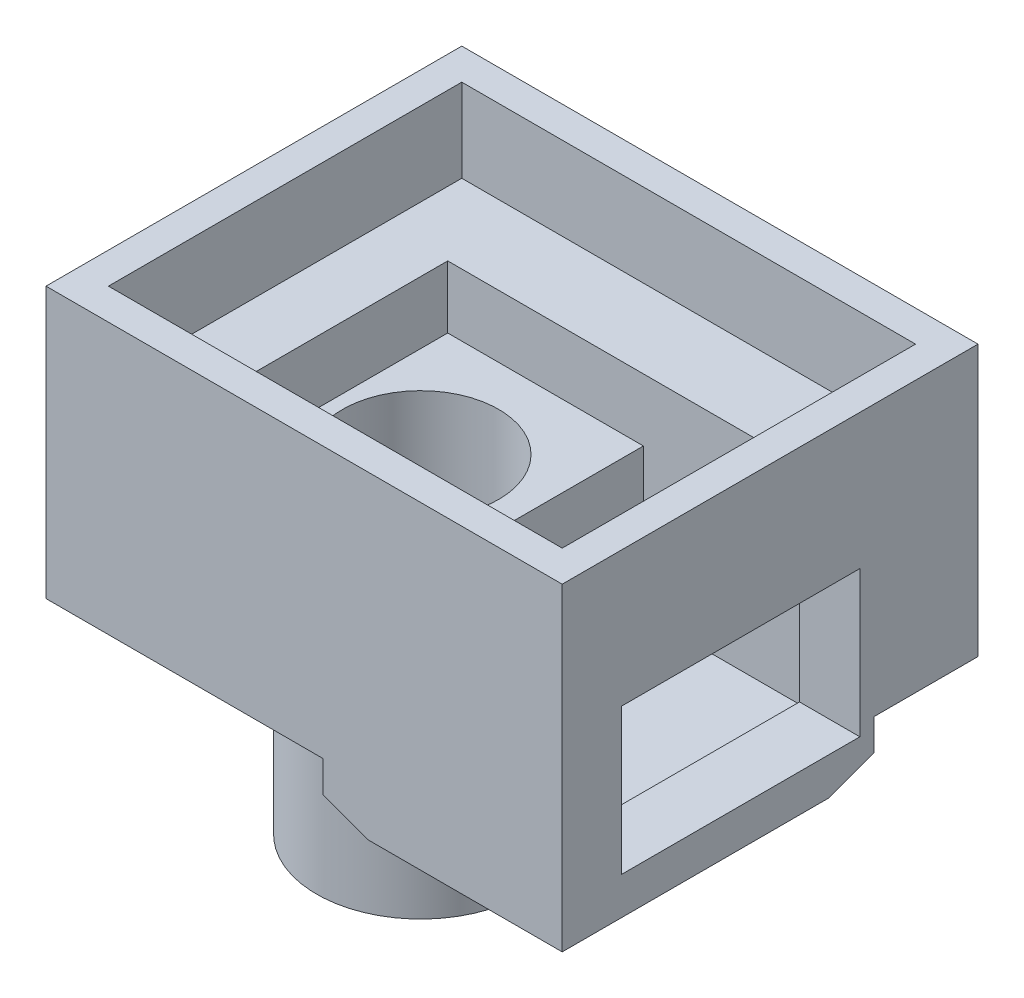
from build123d import *
from OCP.BRepFilletAPI import BRepFilletAPI_MakeChamfer

# Parameters (mm, degrees)
SKETCH1_R            = 4.999999999999999
SKETCH1_R_2          = 2.5
BOSS_EXTRUDE1_DEPTH  = 15.8
SKETCH2_R            = 3.75
CUT_EXTRUDE1_DEPTH   = 13
CUT_EXTRUDE2_DEPTH   = 19.135324645563973
BOSS_EXTRUDE3_DEPTH  = 1
BOSS_EXTRUDE4_DEPTH  = 1
SKETCH13_R           = 5
BOSS_EXTRUDE7_DEPTH  = 10
CUT_EXTRUDE3_START   = -4
CUT_EXTRUDE3_DEPTH   = 4
CUT_EXTRUDE4_DEPTH   = 1
BOSS_EXTRUDE9_DEPTH  = 3
CUT_EXTRUDE6_DEPTH   = 7
BOSS_EXTRUDE10_DEPTH = 3
BOSS_EXTRUDE11_DEPTH = 2
CUT_EXTRUDE7_DEPTH   = 0.25
BOSS_EXTRUDE12_DEPTH = 1
SKETCH23_W           = 18.9749371855331
SKETCH23_H           = 13
BOSS_EXTRUDE13_DEPTH = 1
SKETCH24_W           = 23.799999999999997
SKETCH24_H           = 13
BOSS_EXTRUDE14_DEPTH = 1
BOSS_EXTRUDE15_DEPTH = 1
SKETCH26_W           = 11.45
SKETCH26_H           = 6.999999999999998
SKETCH26_W_2         = 10.45
SKETCH26_H_2         = 5.999999999999998
CUT_EXTRUDE8_DEPTH   = 34.46489573009899
CUT_EXTRUDE10_DEPTH  = 0.7
CHAMFER4_SIZE        = 0.8
CHAMFER4_SIZE2       = 2.1979819355637176


with BuildPart() as part:
    # Sketch1 → Boss-Extrude1 (new body)
    # profile 1 of 2: a face of its own
    with BuildSketch(Plane(origin=(0, 0, 0), x_dir=(1, 0, 0), z_dir=(0, 1, 0))):
        with BuildLine():
            Line((-0.5, 7), (-0.5, 4.9749371855331))
            ThreePointArc((-0.5000000000000004, 4.974937185533099), (3.1e-16, 4.999999999999999), (0.49999999999999994, 4.974937185533099))
            Line((0.5, 4.9749371855331), (0.5, 7))
            Line((0.5, 7), (-0.5, 7))
        make_face()
    # profile 2 of 2: a face of its own
    with BuildSketch(Plane(origin=(0, 0, 0), x_dir=(1, 0, 0), z_dir=(0, 1, 0))):
        Circle(SKETCH1_R)
        with Locations(Location((0, 0, 0), (0, 0, 270))):
            Circle(SKETCH1_R_2, mode=Mode.SUBTRACT)
    extrude(amount=BOSS_EXTRUDE1_DEPTH)

    # Sketch2 → Cut-Extrude1 (cut)
    with BuildSketch(Plane(origin=(0, 15.8, 0), x_dir=(1, 0, 0), z_dir=(0, 1, 0))):
        with Locations(Location((0, 0, 0), (0, 0, 270))):
            Circle(SKETCH2_R)
    extrude(amount=-CUT_EXTRUDE1_DEPTH, mode=Mode.SUBTRACT)

    # Sketch4 → Cut-Extrude2 (cut, through all)
    with BuildSketch(Plane(origin=(0.5, 0, 0), x_dir=(0, 0, -1), z_dir=(1, 0, 0))):
        Polygon((7, 0), (4.9749371855331, 0), (4.9749371855331, 2.5000000000000004), (7, 2.5), align=None)
    extrude(amount=-CUT_EXTRUDE2_DEPTH, mode=Mode.SUBTRACT)

    # Sketch10 → Boss-Extrude3 (add)
    with BuildSketch(Plane(origin=(0.5, 0, 0), x_dir=(0, 0, -1), z_dir=(1, 0, 0))):
        Polygon((4.9749371855331, 15.8), (9.974937185533099, 15.8), (9.974937185533099, 9.8), (4.974937185533101, 9.8), align=None)
    extrude(amount=-BOSS_EXTRUDE3_DEPTH)

    # Sketch12 → Boss-Extrude4 (add)
    with BuildSketch(Plane(origin=(0, 15.8, 0), x_dir=(1, 0, 0), z_dir=(0, 1, 0))):
        with BuildLine():
            Line((-3.75, -3.307189138830739), (-3.75, 3.307189138830739))
            ThreePointArc((-3.75, 3.307189138830739), (-5.000000000000001, -6.1e-16), (-3.75, -3.307189138830739))
        make_face()
    extrude(amount=BOSS_EXTRUDE4_DEPTH)

    # Sketch13 → Boss-Extrude7 (add)
    with BuildSketch(Plane.XZ.offset(-9.8)):
        Polygon((-8, 8), (14.799999999999997, 8), (14.8, -9.974937185533099), (-7.999999999999998, -9.974937185533099), align=None)
        with Locations(Location((0, 0, 0), (0, 0, 221.409622109))):
            Circle(SKETCH13_R, mode=Mode.SUBTRACT)
    extrude(amount=-BOSS_EXTRUDE7_DEPTH)

    # Sketch14 → Cut-Extrude3 (cut)
    with BuildSketch(Plane(origin=(0, 19.8, 0), x_dir=(1, 0, 0), z_dir=(0, 1, 0)).offset(CUT_EXTRUDE3_START)):
        Polygon((-4.400000000000001, 5.7), (10.299999999999999, 5.7), (12.899999999999999, 5.7), (12.899999999999999, -7.249999999999999), (10.3, -7.249999999999999), (-4.400000000000001, -7.249999999999999), align=None)
    extrude(amount=CUT_EXTRUDE3_DEPTH, mode=Mode.SUBTRACT)

    # Sketch15 → Cut-Extrude4 (cut)
    with BuildSketch(Plane(origin=(0, 19.8, 0), x_dir=(1, 0, 0), z_dir=(0, 1, 0))):
        Polygon((-7.499999999999998, 9.474937185533099), (-7.5, -7.5), (14.299999999999997, -7.5), (14.3, 9.474937185533099), align=None)
    extrude(amount=-CUT_EXTRUDE4_DEPTH, mode=Mode.SUBTRACT)

    # Sketch17 → Boss-Extrude9 (add)
    with BuildSketch(Plane.XZ.offset(-9.8)):
        Polygon((14.8, -5.974937185533098), (4.3, -5.974937185533099), (4.3, 8), (14.8, 8), align=None)
    extrude(amount=BOSS_EXTRUDE9_DEPTH)

    # Sketch16 → Cut-Extrude6 (cut)
    with BuildSketch(Plane(origin=(0, 15.8, 0), x_dir=(1, 0, 0), z_dir=(0, 1, 0))):
        Polygon((12.899999999999999, 5.7), (4.999999999999999, 5.699999999999999), (5.000000000000001, -7.249999999999999), (12.9, -7.249999999999999), align=None)
    extrude(amount=-CUT_EXTRUDE6_DEPTH, mode=Mode.SUBTRACT)

    # Sketch19 → Boss-Extrude10 (add)
    with BuildSketch(Plane(origin=(0, 19.8, 0), x_dir=(1, 0, 0), z_dir=(0, 1, 0))):
        Polygon((-7.999999999999998, 9.974937185533099), (-8, -8), (14.799999999999997, -8), (14.8, 9.974937185533099), align=None)
        Polygon((-7.5, -7.5), (14.299999999999997, -7.5), (14.3, 9.474937185533099), (-7.499999999999998, 9.474937185533099), align=None, mode=Mode.SUBTRACT)
    extrude(amount=BOSS_EXTRUDE10_DEPTH)

    # Sketch20 → Boss-Extrude11 (add)
    with BuildSketch(Plane(origin=(0, 16.8, 0), x_dir=(1, 0, 0), z_dir=(0, 1, 0))):
        with BuildLine():
            Line((-4.400000000000002, -2.37486841740758), (-4.400000000000001, 2.374868417407581))
            ThreePointArc((-4.400000000000001, 2.374868417407581), (-5, 6.1e-16), (-4.400000000000002, -2.37486841740758))
        make_face()
    extrude(amount=BOSS_EXTRUDE11_DEPTH)

    # Sketch21 → Cut-Extrude7 (cut)
    with BuildSketch(Plane(origin=(0, 0, 7.249999999999999), x_dir=(-1, 0, 0), z_dir=(0, 0, -1))):
        Polygon((4.400000000000001, 18.8), (-12.899999999999999, 18.8), (-12.9, 8.800000000000002), (-5.000000000000001, 8.800000000000002), (-5.000000000000001, 15.8), (4.400000000000001, 15.8), align=None)
    extrude(amount=-CUT_EXTRUDE7_DEPTH, mode=Mode.SUBTRACT)

    # Sketch22 → Boss-Extrude12 (add)
    with BuildSketch(Plane.XY.offset(8)):
        Polygon((14.8, 6.800000000000002), (14.799999999999997, 22.8), (-8, 22.8), (-8, 9.8), (4.3, 9.8), (4.3, 6.800000000000002), align=None)
    extrude(amount=BOSS_EXTRUDE12_DEPTH)

    # Sketch23 → Boss-Extrude13 (add)
    with BuildSketch(Plane.ZY.offset(8)):
        with Locations((-0.4874685927665485, 16.3)):
            Rectangle(SKETCH23_W, SKETCH23_H)
    extrude(amount=BOSS_EXTRUDE13_DEPTH)

    # Sketch24 → Boss-Extrude14 (add)
    with BuildSketch(Plane(origin=(0, 0, -9.974937185533099), x_dir=(-1, 0, 0), z_dir=(0, 0, -1))):
        with Locations((-2.9000000000000012, 16.3)):
            Rectangle(SKETCH24_W, SKETCH24_H)
    extrude(amount=BOSS_EXTRUDE14_DEPTH)

    # Sketch25 → Boss-Extrude15 (add)
    with BuildSketch(Plane(origin=(14.799999999999999, 0, 2.86e-15), x_dir=(1.9e-16, 0, -1), z_dir=(1, 0, 1.9e-16))):
        Polygon((5.974937185533101, 9.8), (10.974937185533104, 9.8), (10.974937185533104, 22.8), (-8.999999999999998, 22.8), (-8.999999999999998, 6.800000000000002), (5.974937185533101, 6.800000000000002), align=None)
    extrude(amount=BOSS_EXTRUDE15_DEPTH)

    # Sketch26 → Cut-Extrude8 (cut, through all)
    with BuildSketch(Plane.ZY.offset(-12.899999999999999)):
        with Locations((0.42500000000000027, 12.8)):
            Rectangle(SKETCH26_W, SKETCH26_H)
        with Locations((0.4249999999999998, 12.8)):
            Rectangle(SKETCH26_W_2, SKETCH26_H_2)
    extrude(amount=-CUT_EXTRUDE8_DEPTH, mode=Mode.SUBTRACT)

    # Sketch28 → Cut-Extrude10 (cut)
    with BuildSketch(Plane.XZ.offset(-6.800000000000002)):
        with BuildLine():
            Line((4.3, -2.551470164434614), (4.3, -5.974937185533099))
            Line((4.3, -5.974937185533099), (15.8, -5.974937185533098))
            Line((15.8, -5.974937185533098), (15.799999999999999, 9.000000000000002))
            Line((15.799999999999999, 9.000000000000002), (4.3, 9.000000000000002))
            Line((4.3, 9.000000000000002), (4.3, 2.5514701644346127))
            ThreePointArc((4.3, 2.5514701644346127), (4.999999999999999, -5.6e-16), (4.3, -2.551470164434614))
        make_face()
    extrude(amount=-CUT_EXTRUDE10_DEPTH, mode=Mode.SUBTRACT)

    # Chamfer4: one chamfer whose edges measure the first distance from different faces: ONE call of the kernel's chamfer builder (chamfer() names one face for all edges)
    chamfer4_edges_1 = [part.edges().sort_by_distance(p)[0] for p in [
        (10.05, 7.500000000000002, -5.974937185533099),
    ]]
    chamfer4_side_1 = [part.faces().sort_by_distance(p)[0] for p in [
        (10.049999999999999, 8.65, -5.974937185533099),
    ]]
    chamfer4_edges_2 = [part.edges().sort_by_distance(p)[0] for p in [
        (4.3, 7.500000000000002, -4.263203674983856),
    ]]
    chamfer4_side_2 = [part.faces().sort_by_distance(p)[0] for p in [
        (4.3, 8.650000000000002, -4.263203674983856),
    ]]
    chamfer4 = BRepFilletAPI_MakeChamfer(part.part.solid().wrapped)
    for e in chamfer4_edges_1:
        chamfer4.Add(CHAMFER4_SIZE, CHAMFER4_SIZE2, e.wrapped, chamfer4_side_1[0].wrapped)  # the first distance lies on this face
    for e in chamfer4_edges_2:
        chamfer4.Add(CHAMFER4_SIZE, CHAMFER4_SIZE2, e.wrapped, chamfer4_side_2[0].wrapped)  # the first distance lies on this face
    add(Compound.cast(chamfer4.Shape()), mode=Mode.REPLACE)


solid = part.part
